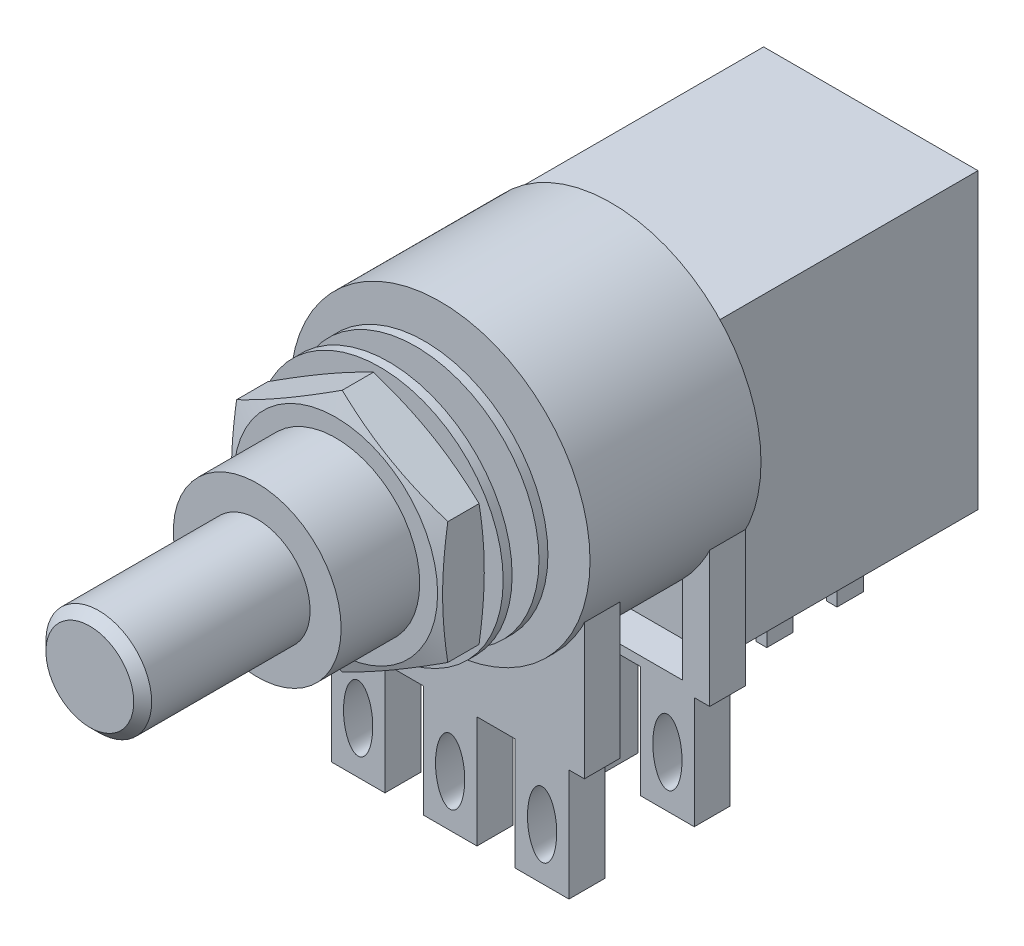
from build123d import *

# Parameters (mm, degrees)
SKETCH1_R              = 3
BOSS_EXTRUDE1_DEPTH    = 19
SKETCH1_3_R            = 4.7625
SKETCH1_3_R_2          = 3
BOSS_EXTRUDE2_DEPTH    = 9.5
SKETCH1_5_R            = 5.5118
SKETCH1_5_R_2          = 4.7625
BOSS_EXTRUDE3_DEPTH    = 0.889
BOSS_EXTRUDE4_START    = -0.889
SKETCH1_6_R            = 8.5
SKETCH1_6_R_2          = 5.5118
BOSS_EXTRUDE4_DEPTH    = 9.7028
SKETCH2_W              = 12.1666
SKETCH2_H              = 16.6624
BOSS_EXTRUDE5_DEPTH    = 14.732
SKETCH3_W              = 3.048
SKETCH3_H              = 6.35
BOSS_EXTRUDE6_DEPTH    = 2.032
BOSS_EXTRUDE9_START    = 9.144
SKETCH3_3_W            = 3.048
SKETCH3_3_H            = 6.35
SKETCH3_3_W_2          = 12.1666
SKETCH3_3_H_2          = 10.9056
BOSS_EXTRUDE9_DEPTH    = 2.032
SKETCH4_W              = 0.6096
SKETCH4_H              = 1.4986
BOSS_EXTRUDE10_DEPTH   = 4.064
BOSS_EXTRUDE10_2_DEPTH = 4.064
BOSS_EXTRUDE10_3_DEPTH = 4.064
BOSS_EXTRUDE10_4_DEPTH = 4.064
BOSS_EXTRUDE10_5_DEPTH = 4.064
BOSS_EXTRUDE10_6_DEPTH = 4.064
CHAMFER1_SIZE          = 0.508
SKETCH6_R              = 7
SKETCH6_R_2            = 4.75
BOSS_EXTRUDE11_DEPTH   = 0.508
SKETCH8_R              = 4.7625
BOSS_EXTRUDE12_DEPTH   = 2.5
BOSS_EXTRUDE15_START   = -2.032
SKETCH6_2_R            = 7
SKETCH6_2_R_2          = 4.75
BOSS_EXTRUDE15_DEPTH   = 0.508


with BuildPart() as part:
    # Sketch1 → Boss-Extrude1 (new body)
    with BuildSketch(Plane.XY):
        Circle(SKETCH1_R)
    extrude(amount=BOSS_EXTRUDE1_DEPTH)



with BuildPart() as body_2:
    # Sketch1<3> → Boss-Extrude2 (new body)
    with BuildSketch(Plane.XY):
        Circle(SKETCH1_3_R)
        Circle(SKETCH1_3_R_2, mode=Mode.SUBTRACT)
    extrude(amount=BOSS_EXTRUDE2_DEPTH)


with BuildPart() as part_1:
    add(part.part)

    add(body_2.part)  # Boss-Extrude3 merges body 2
    # Sketch1<5> → Boss-Extrude3 (add)
    with BuildSketch(Plane.XY):
        Circle(SKETCH1_5_R)
        Circle(SKETCH1_5_R_2, mode=Mode.SUBTRACT)
    extrude(amount=-BOSS_EXTRUDE3_DEPTH)

    # Chamfer1
    chamfer1_edges = [part_1.edges().sort_by_distance(p)[0] for p in [
        (-3, 0, 19),
    ]]
    chamfer(chamfer1_edges, length=CHAMFER1_SIZE)



with BuildPart() as body_2_2:
    # Sketch1<6> → Boss-Extrude4 (new body)
    with BuildSketch(Plane.XY.offset(BOSS_EXTRUDE4_START)):
        Circle(SKETCH1_6_R)
        Circle(SKETCH1_6_R_2, mode=Mode.SUBTRACT)
    extrude(amount=-BOSS_EXTRUDE4_DEPTH)


with BuildPart() as body_3:
    # Sketch2 → Boss-Extrude5 (new body)
    with BuildSketch(Plane(origin=(0, 0, -10.5918), x_dir=(-1, 0, 0), z_dir=(0, 0, -1))):
        with Locations((0, -2.5744)):
            Rectangle(SKETCH2_W, SKETCH2_H)
    extrude(amount=BOSS_EXTRUDE5_DEPTH)


with BuildPart() as body_4:
    # Sketch3 → Boss-Extrude6 (new body)
    # profile 1 of 4: a face of its own
    with BuildSketch(Plane.XY.offset(-10.5918)):
        Polygon((-6.0833, 0), (-7.62, 0), (-7.62, -11.43), (-6.744173621, -11.43), (-3.696173621, -11.43), (-1.524, -11.43), (1.524, -11.43), (3.696173621, -11.43), (6.744173621, -11.43), (7.62, -11.43), (7.62, 0), (6.0833, 0), (6.0833, -10.9056), (-6.0833, -10.9056), align=None)
    # profile 2 of 4: a face of its own
    with BuildSketch(Plane.XY.offset(-10.5918)):
        with Locations((5.220173621, -14.605)):
            Rectangle(SKETCH3_W, SKETCH3_H)
        with BuildLine():
            add(Edge.make_bspline(
                [(5.220173621, -13.006234108), (3.783189093, -13.006234108), (4.501681357, -15.802500684), (5.220173621, -18.598767261), (5.938665886, -15.802500684), (6.65715815, -13.006234108), (5.220173621, -13.006234108)],
                knots=[0, 0, 0, 2.094395102, 2.094395102, 4.188790205, 4.188790205, 6.283185307, 6.283185307, 6.283185307], degree=2, weights=[1, 0.5, 1, 0.5, 1, 0.5, 1]))
        make_face(mode=Mode.SUBTRACT)
    # profile 3 of 4: a face of its own
    with BuildSketch(Plane.XY.offset(-10.5918)):
        with Locations((0, -14.605)):
            Rectangle(SKETCH3_W, SKETCH3_H)
        with BuildLine():
            add(Edge.make_bspline(
                [(0, -16.734589543), (1.436984529, -16.734589543), (0.718492264, -13.938322967), (0, -11.14205639), (-0.718492264, -13.938322967), (-1.436984529, -16.734589543), (0, -16.734589543)],
                knots=[0, 0, 0, 2.094395102, 2.094395102, 4.188790205, 4.188790205, 6.283185307, 6.283185307, 6.283185307], degree=2, weights=[1, 0.5, 1, 0.5, 1, 0.5, 1]))
        make_face(mode=Mode.SUBTRACT)
    # profile 4 of 4: a face of its own
    with BuildSketch(Plane.XY.offset(-10.5918)):
        with Locations((-5.220173621, -14.605)):
            Rectangle(SKETCH3_W, SKETCH3_H)
        with BuildLine():
            add(Edge.make_bspline(
                [(-5.220173621, -13.006234108), (-6.65715815, -13.006234108), (-5.938665886, -15.802500684), (-5.220173621, -18.598767261), (-4.501681357, -15.802500684), (-3.783189093, -13.006234108), (-5.220173621, -13.006234108)],
                knots=[0, 0, 0, 2.094395102, 2.094395102, 4.188790205, 4.188790205, 6.283185307, 6.283185307, 6.283185307], degree=2, weights=[1, 0.5, 1, 0.5, 1, 0.5, 1]))
        make_face(mode=Mode.SUBTRACT)
    extrude(amount=BOSS_EXTRUDE6_DEPTH)


with BuildPart() as body_5:
    # Sketch3<3> → Boss-Extrude9 (new body)
    # profile 1 of 5: a face of its own
    with BuildSketch(Plane.XY.offset(-10.5918).offset(BOSS_EXTRUDE9_START)):
        with Locations((-5.220173621, -14.605)):
            Rectangle(SKETCH3_3_W, SKETCH3_3_H)
        with BuildLine():
            add(Edge.make_bspline(
                [(-5.220173621, -13.006234108), (-6.65715815, -13.006234108), (-5.938665886, -15.802500684), (-5.220173621, -18.598767261), (-4.501681357, -15.802500684), (-3.783189093, -13.006234108), (-5.220173621, -13.006234108)],
                knots=[0, 0, 0, 2.094395102, 2.094395102, 4.188790205, 4.188790205, 6.283185307, 6.283185307, 6.283185307], degree=2, weights=[1, 0.5, 1, 0.5, 1, 0.5, 1]))
        make_face(mode=Mode.SUBTRACT)
    # profile 2 of 5: a face of its own
    with BuildSketch(Plane.XY.offset(-10.5918).offset(BOSS_EXTRUDE9_START)):
        with Locations((0, -14.605)):
            Rectangle(SKETCH3_3_W, SKETCH3_3_H)
        with BuildLine():
            add(Edge.make_bspline(
                [(0, -16.734589543), (1.436984529, -16.734589543), (0.718492264, -13.938322967), (0, -11.14205639), (-0.718492264, -13.938322967), (-1.436984529, -16.734589543), (0, -16.734589543)],
                knots=[0, 0, 0, 2.094395102, 2.094395102, 4.188790205, 4.188790205, 6.283185307, 6.283185307, 6.283185307], degree=2, weights=[1, 0.5, 1, 0.5, 1, 0.5, 1]))
        make_face(mode=Mode.SUBTRACT)
    # profile 3 of 5: a face of its own
    with BuildSketch(Plane.XY.offset(-10.5918).offset(BOSS_EXTRUDE9_START)):
        with Locations((5.220173621, -14.605)):
            Rectangle(SKETCH3_3_W, SKETCH3_3_H)
        with BuildLine():
            add(Edge.make_bspline(
                [(5.220173621, -13.006234108), (3.783189093, -13.006234108), (4.501681357, -15.802500684), (5.220173621, -18.598767261), (5.938665886, -15.802500684), (6.65715815, -13.006234108), (5.220173621, -13.006234108)],
                knots=[0, 0, 0, 2.094395102, 2.094395102, 4.188790205, 4.188790205, 6.283185307, 6.283185307, 6.283185307], degree=2, weights=[1, 0.5, 1, 0.5, 1, 0.5, 1]))
        make_face(mode=Mode.SUBTRACT)
    # profile 4 of 5: a face of its own
    with BuildSketch(Plane.XY.offset(-10.5918).offset(BOSS_EXTRUDE9_START)):
        Polygon((-6.0833, 0), (-7.62, 0), (-7.62, -11.43), (-6.744173621, -11.43), (-3.696173621, -11.43), (-1.524, -11.43), (1.524, -11.43), (3.696173621, -11.43), (6.744173621, -11.43), (7.62, -11.43), (7.62, 0), (6.0833, 0), (6.0833, -10.9056), (-6.0833, -10.9056), align=None)
    # profile 5 of 5: a face of its own
    with BuildSketch(Plane.XY.offset(-10.5918).offset(BOSS_EXTRUDE9_START)):
        with Locations((0, -5.4528)):
            Rectangle(SKETCH3_3_W_2, SKETCH3_3_H_2)
    extrude(amount=-BOSS_EXTRUDE9_DEPTH)


with BuildPart() as body_6:
    # Sketch4 → Boss-Extrude10 (new body)
    with BuildSketch(Plane.XZ.offset(10.9056)):
        with Locations((-2.5019, -13.3731)):
            Rectangle(SKETCH4_W, SKETCH4_H)
    extrude(amount=BOSS_EXTRUDE10_DEPTH)


with BuildPart() as body_7:
    # Sketch4 → Boss-Extrude10 2 (new body)
    with BuildSketch(Plane.XZ.offset(10.9056)):
        with Locations((-2.5019, -17.3609)):
            Rectangle(SKETCH4_W, SKETCH4_H)
    extrude(amount=BOSS_EXTRUDE10_2_DEPTH)


with BuildPart() as body_8:
    # Sketch4 → Boss-Extrude10 3 (new body)
    with BuildSketch(Plane.XZ.offset(10.9056)):
        with Locations((-2.5019, -21.3487)):
            Rectangle(SKETCH4_W, SKETCH4_H)
    extrude(amount=BOSS_EXTRUDE10_3_DEPTH)


with BuildPart() as body_9:
    # Sketch4 → Boss-Extrude10 4 (new body)
    with BuildSketch(Plane.XZ.offset(10.9056)):
        with Locations((2.5019, -13.3731)):
            Rectangle(SKETCH4_W, SKETCH4_H)
    extrude(amount=BOSS_EXTRUDE10_4_DEPTH)


with BuildPart() as body_10:
    # Sketch4 → Boss-Extrude10 5 (new body)
    with BuildSketch(Plane.XZ.offset(10.9056)):
        with Locations((2.5019, -17.3609)):
            Rectangle(SKETCH4_W, SKETCH4_H)
    extrude(amount=BOSS_EXTRUDE10_5_DEPTH)


with BuildPart() as body_11:
    # Sketch4 → Boss-Extrude10 6 (new body)
    with BuildSketch(Plane.XZ.offset(10.9056)):
        with Locations((2.5019, -21.3487)):
            Rectangle(SKETCH4_W, SKETCH4_H)
    extrude(amount=BOSS_EXTRUDE10_6_DEPTH)


with BuildPart() as body_12:
    # Sketch6 → Boss-Extrude11 (new body)
    with BuildSketch(Plane.XY.offset(2.032)):
        Circle(SKETCH6_R)
        Circle(SKETCH6_R_2, mode=Mode.SUBTRACT)
    extrude(amount=BOSS_EXTRUDE11_DEPTH)


with BuildPart() as part_2:
    add(part_1.part)

    add(body_12.part)  # Boss-Extrude12 merges body 12
    # Sketch8 → Boss-Extrude12 (add)
    with BuildSketch(Plane.XY.offset(2.54)):
        Polygon((0, 6.921736907), (-5.9944, 3.460868454), (-5.9944, -3.460868454), (0, -6.921736907), (5.9944, -3.460868454), (5.9944, 3.460868454), align=None)
        Circle(SKETCH8_R, mode=Mode.SUBTRACT)
    extrude(amount=BOSS_EXTRUDE12_DEPTH)

    # Sketch9 → Cut-Revolve3 (revolve, cut)
    with BuildSketch(Plane(origin=(0, 0, 0), x_dir=(1, 0, 0), z_dir=(0, 1, 0)), mode=Mode.PRIVATE) as cut_revolve3_sk:
        Polygon((5.778862411, -5.04), (8.543901209, -4.162517583), (8.543901209, -5.04), align=None)
        Polygon((8.543901209, -2.54), (5.778862411, -2.54), (8.543901209, -3.417482417), align=None)
    revolve(cut_revolve3_sk.sketch.rotate(Axis((0, 0, 0), (0, 0, 1)), 180), axis=Axis((0, 0, 0), (0, 0, 1)), mode=Mode.SUBTRACT)


with BuildPart() as body_12_2:
    # Sketch6<2> → Boss-Extrude15 (new body)
    with BuildSketch(Plane.XY.offset(2.032).offset(BOSS_EXTRUDE15_START)):
        Circle(SKETCH6_2_R)
        Circle(SKETCH6_2_R_2, mode=Mode.SUBTRACT)
    extrude(amount=BOSS_EXTRUDE15_DEPTH)


solid = Compound([body_2_2.part, body_3.part, body_4.part, body_5.part, body_6.part, body_7.part, body_8.part, body_9.part, body_10.part, body_11.part, part_2.part, body_12_2.part])
